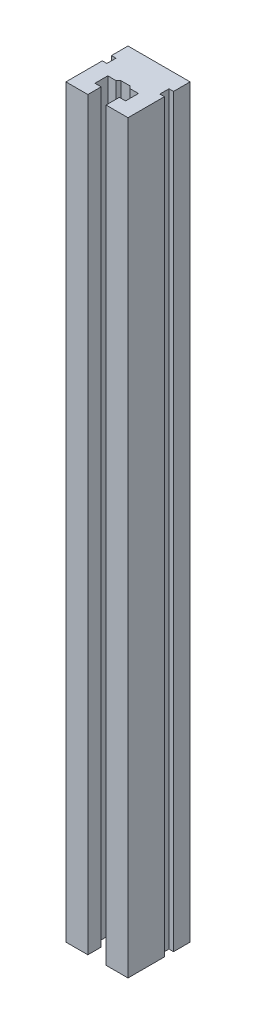
from build123d import *

# Parameters (mm, degrees)
BOSS_EXTRUDE1_DEPTH = 900


with BuildPart() as part:
    # Sketch1 → Boss-Extrude1 (new body)
    with BuildSketch(Plane(origin=(0, 0, 0), x_dir=(1, 0, 0), z_dir=(0, 1, 0))):
        Polygon((37.5, 0), (-37.5, 0), (-37.5, -20), (-32, -20), (-32, -31), (-37.5, -31), (-37.5, -75), (-11, -75), (-11, -58.9), (-18.5, -58.9), (-18.5, -43.4), (-8.4, -43.4), (-5.5, -40.5), (5.5, -40.5), (8.4, -43.4), (18.5, -43.4), (18.5, -58.9), (11, -58.9), (11, -75), (37.5, -75), (37.5, -31), (32, -31), (32, -20), (37.5, -20), align=None)
    extrude(amount=-BOSS_EXTRUDE1_DEPTH)


solid = part.part
